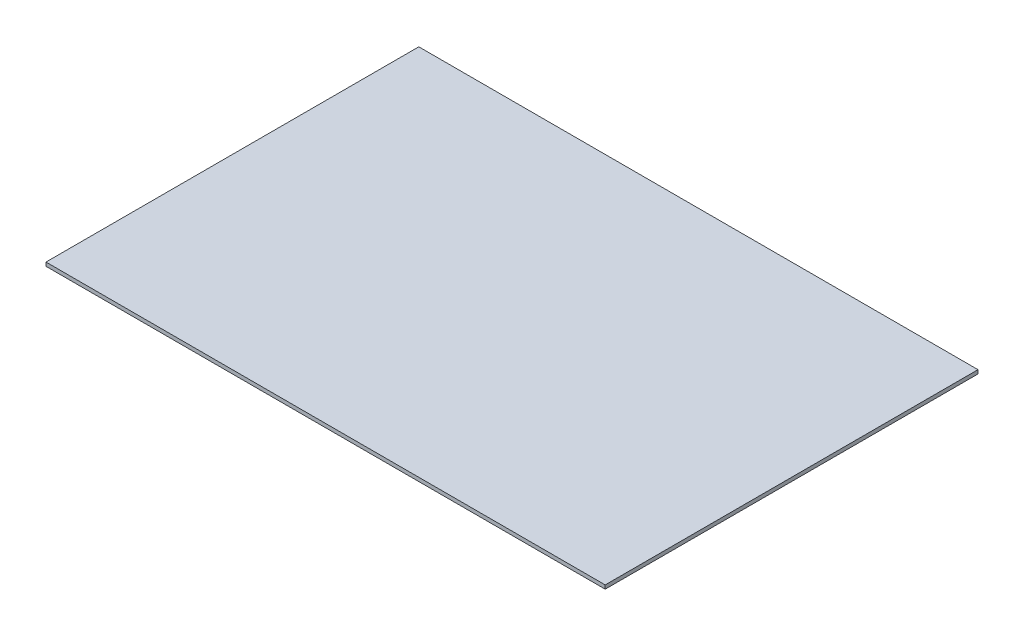
from build123d import *

# Parameters (mm, degrees)
SKETCH1_W           = 1500
SKETCH1_H           = 1000
BOSS_EXTRUDE1_DEPTH = 5


with BuildPart() as part:
    # Sketch1 → Boss-Extrude1 (new, symmetric)
    with BuildSketch(Plane(origin=(0, 0, 0), x_dir=(1, 0, 0), z_dir=(0, 1, 0))):
        Rectangle(SKETCH1_W, SKETCH1_H)
    extrude(amount=BOSS_EXTRUDE1_DEPTH, both=True)


solid = part.part
